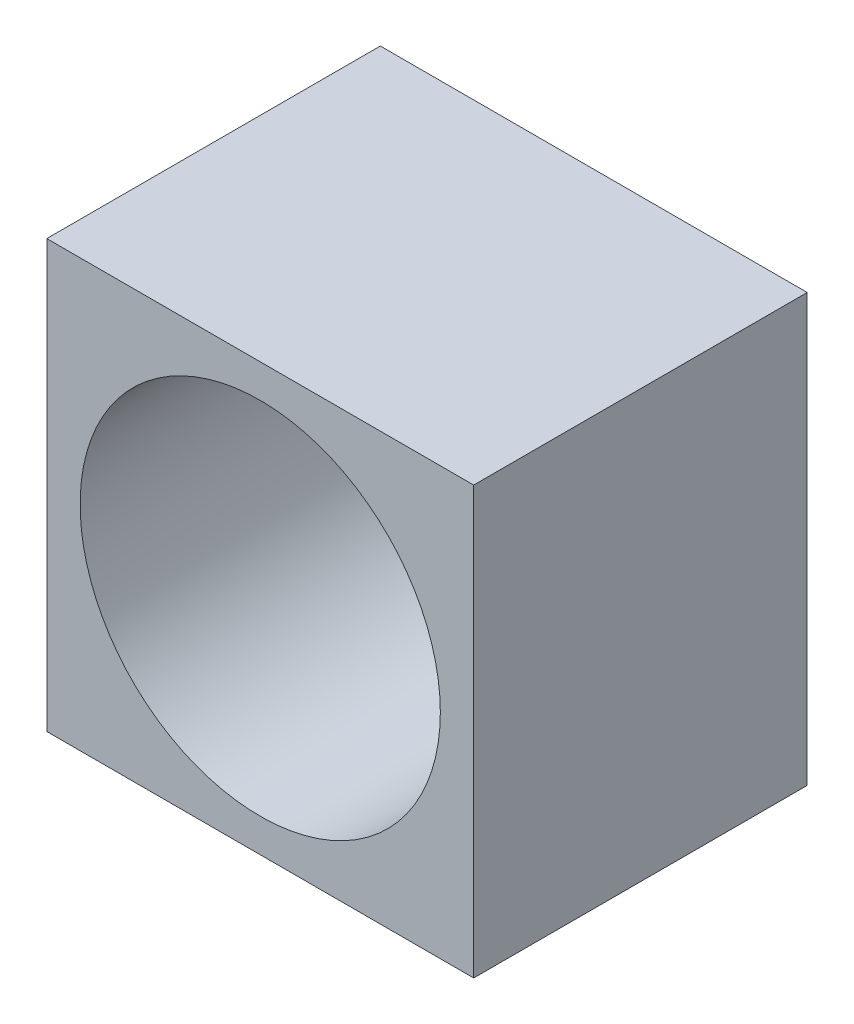
from build123d import *

# Parameters (mm, degrees)
SKETCH_1_W          = 32
SKETCH_1_H          = 32
EXTRUDE_1_DEPTH     = 25
SKETCH_2_R          = 13.5
CUT_EXTRUDE_1_DEPTH = 34.7194306


with BuildPart() as part:
    # Эскиз1 → Бобышка-Вытянуть1 (new body)
    with BuildSketch(Plane.XY):
        Rectangle(SKETCH_1_W, SKETCH_1_H)
    extrude(amount=EXTRUDE_1_DEPTH)

    # Эскиз2 → Вырез-Вытянуть1 (cut, through all)
    with BuildSketch(Plane.XY.offset(25)):
        Circle(SKETCH_2_R)
    extrude(amount=-CUT_EXTRUDE_1_DEPTH, mode=Mode.SUBTRACT)


solid = part.part
